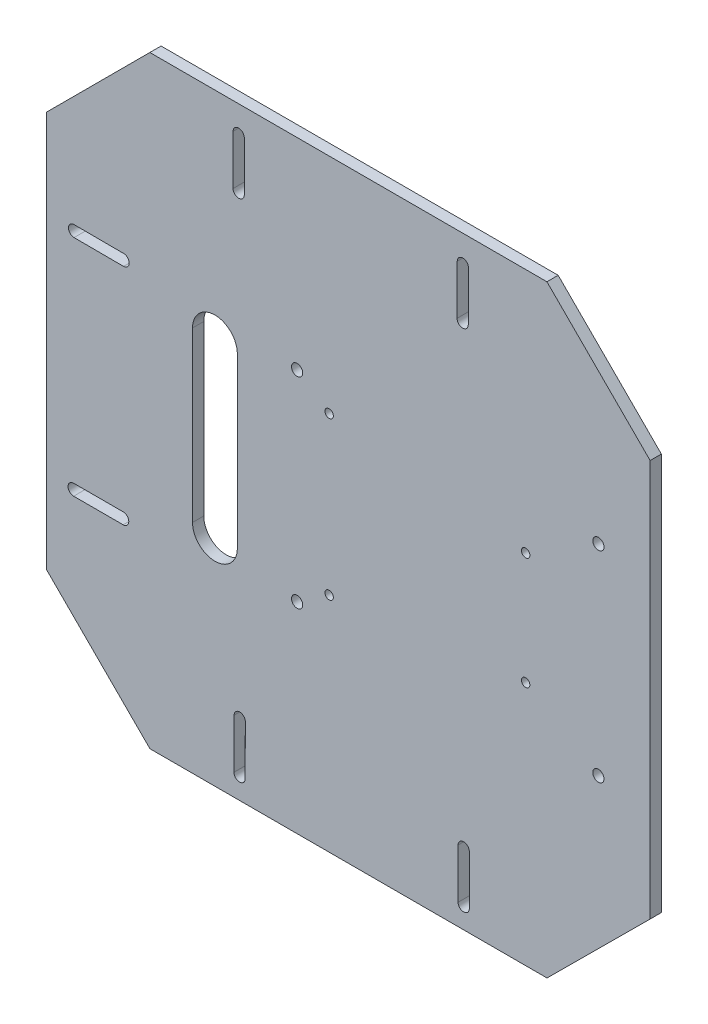
from build123d import *

# Parameters (mm, degrees)
SKETCH1_R           = 1.5
SKETCH1_R_2         = 2
BOSS_EXTRUDE2_DEPTH = 4


with BuildPart() as part:
    # Sketch1 → Boss-Extrude2 (new body)
    with BuildSketch(Plane.XY):
        Polygon((-73.597643579, 117.281365478), (67.863251178, 117.281365478), (104.632803799, 80.511812856), (104.632803799, -60.949081901), (67.894125273, -97.50252168), (-73.566769484, -97.50252168), (-110.367196201, -60.702096755), (-110.367196201, 80.511812856), align=None)
        with Locations((-9.717773474, 37.825883079)):
            Circle(SKETCH1_R, mode=Mode.SUBTRACT)
        with Locations((60.282226526, 29.825883079)):
            Circle(SKETCH1_R, mode=Mode.SUBTRACT)
        with Locations((60.282226526, -10.174116921)):
            Circle(SKETCH1_R, mode=Mode.SUBTRACT)
        with Locations((-9.717773474, -18.174116921)):
            Circle(SKETCH1_R, mode=Mode.SUBTRACT)
        with Locations((-21.13184974, 45.601933923)):
            Circle(SKETCH1_R_2, mode=Mode.SUBTRACT)
        with Locations((86.196302793, 45.601933923)):
            Circle(SKETCH1_R_2, mode=Mode.SUBTRACT)
        with Locations((86.196302793, -25.950167766)):
            Circle(SKETCH1_R_2, mode=Mode.SUBTRACT)
        with Locations((-21.13184974, -25.950167766)):
            Circle(SKETCH1_R_2, mode=Mode.SUBTRACT)
        with BuildLine():
            Line((-58.385806079, -20.095141949), (-58.385806079, 39.904858051))
            ThreePointArc((-58.385806079, 39.904858051), (-50.403357017, 47.887307113), (-42.420907955, 39.904858051))
            Line((-42.420907955, 39.904858051), (-42.420907955, -20.095141949))
            ThreePointArc((-42.420907955, -20.095141949), (-50.403357017, -28.077591011), (-58.385806079, -20.095141949))
        make_face(mode=Mode.SUBTRACT)
        with BuildLine():
            Line((-43.951300834, 90.135788358), (-43.951300834, 107.780882998))
            ThreePointArc((-43.951300834, 107.780882998), (-41.951300834, 109.780882998), (-39.951300834, 107.780882998))
            Line((-39.951300834, 107.780882998), (-39.951300834, 90.135788358))
            ThreePointArc((-39.951300834, 90.135788358), (-41.951300834, 88.135788358), (-43.951300834, 90.135788358))
        make_face(mode=Mode.SUBTRACT)
        with BuildLine():
            Line((39.83957888, 89.970561723), (39.910868679, 107.61551235))
            ThreePointArc((39.910868679, 107.61551235), (37.918965413, 109.623576437), (35.910901326, 107.63167317))
            Line((35.910901326, 107.63167317), (35.839611526, 89.986722543))
            ThreePointArc((35.839611526, 89.986722543), (37.831514793, 87.978658457), (39.83957888, 89.970561723))
        make_face(mode=Mode.SUBTRACT)
        with BuildLine():
            Line((-83.098126059, -33.179247031), (-100.743220699, -33.179247031))
            ThreePointArc((-100.743220699, -33.179247031), (-102.743220699, -31.179247031), (-100.743220699, -29.179247031))
            Line((-100.743220699, -29.179247031), (-83.098126059, -29.179247031))
            ThreePointArc((-83.098126059, -29.179247031), (-81.098126059, -31.179247031), (-83.098126059, -33.179247031))
        make_face(mode=Mode.SUBTRACT)
        with BuildLine():
            Line((-82.932899424, 50.611632682), (-100.577850051, 50.682922481))
            ThreePointArc((-100.577850051, 50.682922481), (-102.585914138, 48.691019215), (-100.594010871, 46.682955128))
            Line((-100.594010871, 46.682955128), (-82.949060244, 46.611665329))
            ThreePointArc((-82.949060244, 46.611665329), (-80.940996157, 48.603568595), (-82.932899424, 50.611632682))
        make_face(mode=Mode.SUBTRACT)
        with BuildLine():
            Line((40.21690933, -72.326072256), (40.21690933, -89.971166897))
            ThreePointArc((40.21690933, -89.971166897), (38.21690933, -91.971166897), (36.21690933, -89.971166897))
            Line((36.21690933, -89.971166897), (36.21690933, -72.326072256))
            ThreePointArc((36.21690933, -72.326072256), (38.21690933, -70.326072256), (40.21690933, -72.326072256))
        make_face(mode=Mode.SUBTRACT)
        with BuildLine():
            Line((-43.573970383, -72.160845622), (-43.645260182, -89.805796249))
            ThreePointArc((-43.645260182, -89.805796249), (-41.653356916, -91.813860335), (-39.645292829, -89.821957069))
            Line((-39.645292829, -89.821957069), (-39.574003029, -72.177006442))
            ThreePointArc((-39.574003029, -72.177006442), (-41.565906296, -70.168942355), (-43.573970383, -72.160845622))
        make_face(mode=Mode.SUBTRACT)
    extrude(amount=BOSS_EXTRUDE2_DEPTH)


solid = part.part
